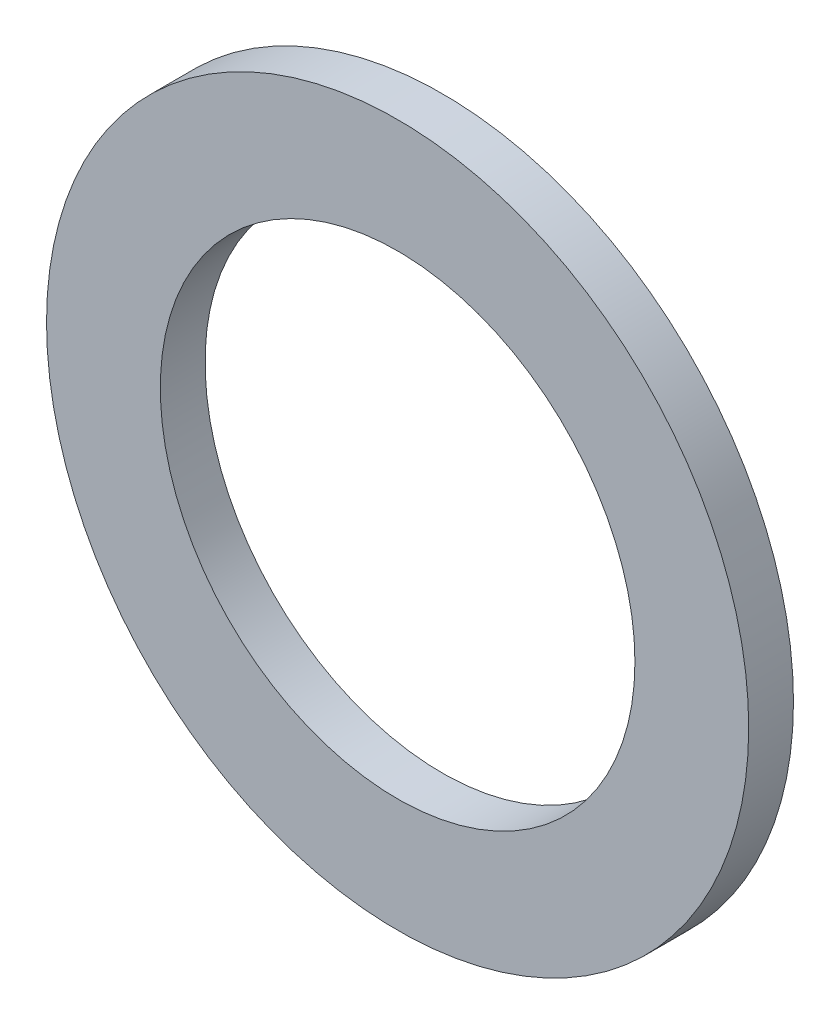
from build123d import *

# Parameters (mm, degrees)
SKETCH1_R           = 39.22
SKETCH1_R_2         = 26.51
BOSS_EXTRUDE1_DEPTH = 5


with BuildPart() as part:
    # Sketch1 → Boss-Extrude1 (new body)
    with BuildSketch(Plane.XY):
        Circle(SKETCH1_R)
        Circle(SKETCH1_R_2, mode=Mode.SUBTRACT)
    extrude(amount=BOSS_EXTRUDE1_DEPTH)


solid = part.part
